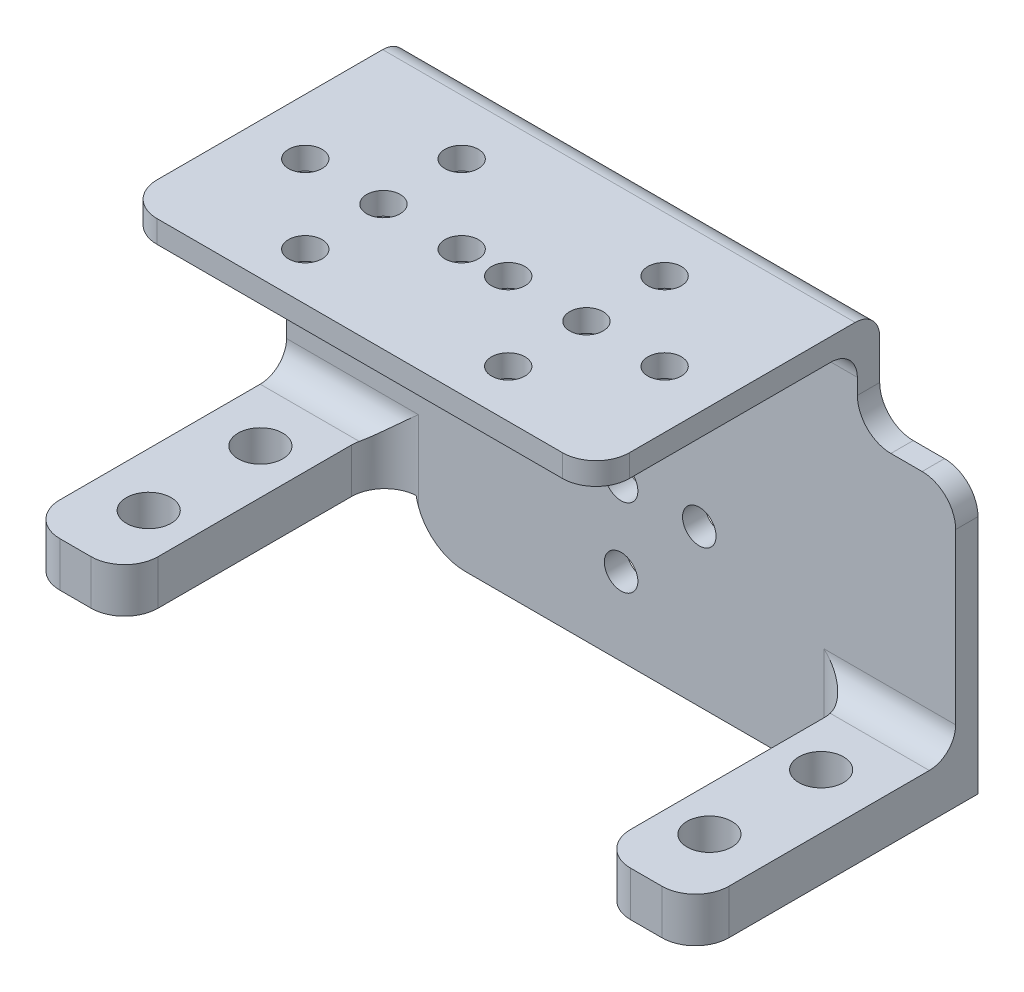
from build123d import *

# Parameters (mm, degrees)
BOSS_EXTRUDE1_DEPTH = 2
SKETCH1_3_W         = 42.3
SKETCH1_3_H         = 2
BOSS_EXTRUDE2_DEPTH = 25.4
SKETCH1_4_W         = 8.8
SKETCH1_4_H         = 4
BOSS_EXTRUDE3_DEPTH = 25.3
FILLET31_R          = 3
FILLET32_R          = 2.36
FILLET26_R          = 2.2
SKETCH2_R           = 2
CUT_EXTRUDE1_DEPTH  = 10
SKETCH3_R           = 1.5
CUT_EXTRUDE2_DEPTH  = 10
SKETCH4_R           = 1.5
CUT_EXTRUDE3_DEPTH  = 10


with BuildPart() as part:
    # Sketch1 → Boss-Extrude1 (new body)
    with BuildSketch(Plane.XY):
        with BuildLine():
            Line((21.15, 16.48), (-21.15, 16.48))
            Line((-21.15, 16.48), (-21.15, 9.72))
            Line((-21.15, 9.72), (-29.95, 9.72))
            Line((-29.95, 9.72), (-29.95, -10.78))
            Line((-29.95, -10.78), (-21.15, -10.78))
            Line((-21.15, -10.78), (-21.15, -14.78))
            Line((-21.15, -14.78), (-18.337899039, -14.78))
            ThreePointArc((-18.337899039, -14.78), (-16.826007676, -17.431106014), (-13.96, -18.48))
            Line((-13.96, -18.48), (13.96, -18.48))
            ThreePointArc((13.96, -18.48), (16.826007676, -17.431106014), (18.337899039, -14.78))
            Line((18.337899039, -14.78), (21.15, -14.78))
            Line((21.15, -14.78), (21.15, -10.78))
            Line((21.15, -10.78), (29.95, -10.78))
            Line((29.95, -10.78), (29.95, 9.72))
            Line((29.95, 9.72), (21.15, 9.72))
            Line((21.15, 9.72), (21.15, 16.48))
        make_face()
    extrude(amount=BOSS_EXTRUDE1_DEPTH)

    # Sketch1<3> → Boss-Extrude2 (add)
    with BuildSketch(Plane.XY):
        with Locations((0, 17.48)):
            Rectangle(SKETCH1_3_W, SKETCH1_3_H)
    extrude(amount=BOSS_EXTRUDE2_DEPTH)

    # Sketch1<4> → Boss-Extrude3 (add)
    with BuildSketch(Plane.XY):
        with Locations((-25.55, -12.78)):
            Rectangle(SKETCH1_4_W, SKETCH1_4_H)
        with Locations((25.55, -12.78)):
            Rectangle(SKETCH1_4_W, SKETCH1_4_H)
    extrude(amount=BOSS_EXTRUDE3_DEPTH)

    # Fillet31
    fillet31_edges = [part.edges().sort_by_distance(p)[0] for p in [
        (21.15, -12.78, 25.3),
        (29.95, -12.78, 25.3),
        (21.15, 17.48, 25.4),
        (-21.15, 17.48, 25.4),
        (-29.95, -12.78, 25.3),
        (-21.15, -12.78, 25.3),
        (-29.95, 9.72, 1),
        (-21.15, 9.72, 1),
        (21.15, 9.72, 1),
        (29.95, 9.72, 1),
        (21.15, -12.78, 2),
        (-21.15, -12.78, 2),
    ]]
    fillet(fillet31_edges, radius=FILLET31_R)

    # Fillet32
    fillet32_edges = [part.edges().sort_by_distance(p)[0] for p in [
        (24.05, -10.78, 2),
        (-24.05, -10.78, 2),
        (0, 16.48, 2),
    ]]
    fillet(fillet32_edges, radius=FILLET32_R)

    # Fillet26
    fillet26_edges = [part.edges().sort_by_distance(p)[0] for p in [
        (0, 18.48, 0),
    ]]
    fillet(fillet26_edges, radius=FILLET26_R)

    # Sketch2 → Cut-Extrude1 (cut, symmetric)
    with BuildSketch(Plane.XZ.offset(14.78)):
        with Locations((25.05, 19.14)):
            Circle(SKETCH2_R)
        with Locations((25.05, 9.14)):
            Circle(SKETCH2_R)
        with Locations((-25.15, 19.14)):
            Circle(SKETCH2_R)
        with Locations((-25.15, 9.14)):
            Circle(SKETCH2_R)
    extrude(amount=CUT_EXTRUDE1_DEPTH, both=True, mode=Mode.SUBTRACT)

    # Sketch3 → Cut-Extrude2 (cut)
    with BuildSketch(Plane(origin=(0, 18.48, 0), x_dir=(1, 0, 0), z_dir=(0, 1, 0))):
        with Locations((-9.134575671, -14.14)):
            Circle(SKETCH3_R)
        with Locations((-9.134575671, -7.14)):
            Circle(SKETCH3_R)
        with Locations((-2.134575671, -14.14)):
            Circle(SKETCH3_R)
        with Locations((-9.134575671, -21.14)):
            Circle(SKETCH3_R)
        with Locations((-16.134575671, -14.14)):
            Circle(SKETCH3_R)
        with Locations((9.034575671, -14.14)):
            Circle(SKETCH3_R)
        with Locations((9.034575671, -7.14)):
            Circle(SKETCH3_R)
        with Locations((16.034575671, -14.14)):
            Circle(SKETCH3_R)
        with Locations((9.034575671, -21.14)):
            Circle(SKETCH3_R)
        with Locations((2.034575671, -14.14)):
            Circle(SKETCH3_R)
    extrude(amount=-CUT_EXTRUDE2_DEPTH, mode=Mode.SUBTRACT)

    # Sketch4 → Cut-Extrude3 (cut)
    with BuildSketch(Plane(origin=(0, 0, 0), x_dir=(-1, 0, 0), z_dir=(0, 0, -1))):
        with Locations((0, 2.48)):
            Circle(SKETCH4_R)
        with Locations((0, -4.52)):
            Circle(SKETCH4_R)
        with Locations((0, -11.52)):
            Circle(SKETCH4_R)
        with Locations((7, -4.52)):
            Circle(SKETCH4_R)
        with Locations((-7, -4.52)):
            Circle(SKETCH4_R)
    extrude(amount=-CUT_EXTRUDE3_DEPTH, mode=Mode.SUBTRACT)


solid = part.part
